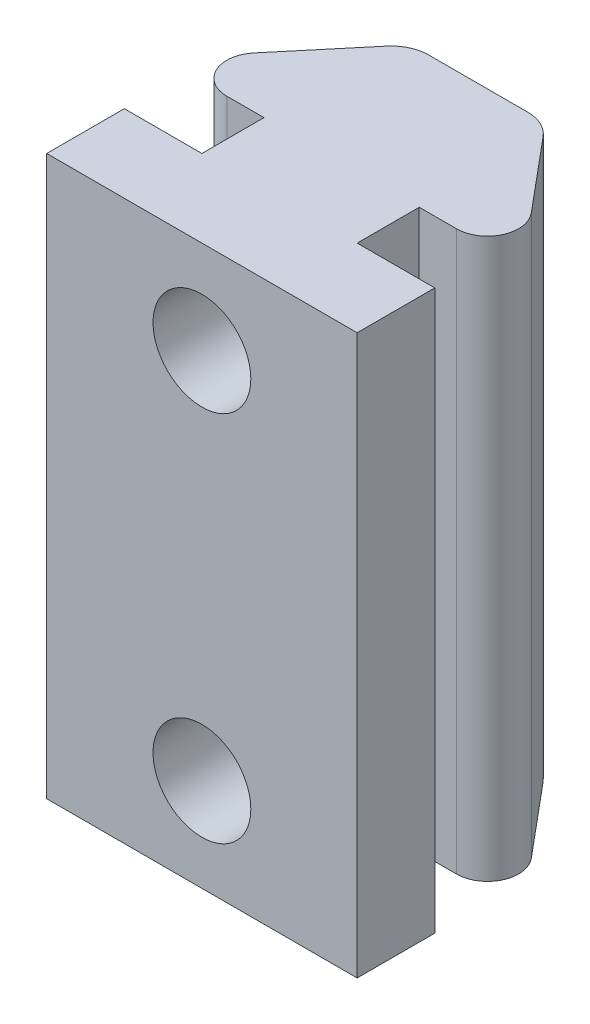
from build123d import *

# Parameters (mm, degrees)
SKETCH1_W           = 12.7
SKETCH1_H           = 22.86
BOSS_EXTRUDE1_DEPTH = 3.175
BOSS_EXTRUDE2_DEPTH = 22.86
SKETCH4_R           = 2
CUT_EXTRUDE1_DEPTH  = 18.283668852


with BuildPart() as part:
    # Sketch1 → Boss-Extrude1 (new body)
    with BuildSketch(Plane.XY):
        Rectangle(SKETCH1_W, SKETCH1_H)
    extrude(amount=BOSS_EXTRUDE1_DEPTH)

    # Sketch2 → Boss-Extrude2 (add)
    with BuildSketch(Plane(origin=(0, 11.43, 0), x_dir=(1, 0, 0), z_dir=(0, 1, 0))):
        with BuildLine():
            Line((3.175, 0), (3.175, 2.54))
            Line((3.175, 2.54), (4.699372999, 2.54))
            ThreePointArc((4.699372999, 2.54), (5.849922417, 3.272286288), (5.673650477, 4.624667659))
            Line((5.673650477, 4.624667659), (3.201132974, 7.581601191))
            ThreePointArc((3.201132974, 7.581601191), (2.677256455, 7.984659302), (2.032, 8.128))
            Line((2.032, 8.128), (-2.032, 8.128))
            ThreePointArc((-2.032, 8.128), (-2.677256455, 7.984659302), (-3.201132974, 7.581601191))
            Line((-3.201132974, 7.581601191), (-5.673650477, 4.624667659))
            ThreePointArc((-5.673650477, 4.624667659), (-5.849922417, 3.272286288), (-4.699372999, 2.54))
            Line((-4.699372999, 2.54), (-3.175, 2.54))
            Line((-3.175, 2.54), (-3.175, 0))
            Line((-3.175, 0), (3.175, 0))
        make_face()
    extrude(amount=-BOSS_EXTRUDE2_DEPTH)

    # Sketch4 → Cut-Extrude1 (cut, through all)
    with BuildSketch(Plane.XY.offset(3.175)):
        with Locations((0, 7.62)):
            Circle(SKETCH4_R)
        with Locations((0, -7.62)):
            Circle(SKETCH4_R)
    extrude(amount=-CUT_EXTRUDE1_DEPTH, mode=Mode.SUBTRACT)


solid = part.part
